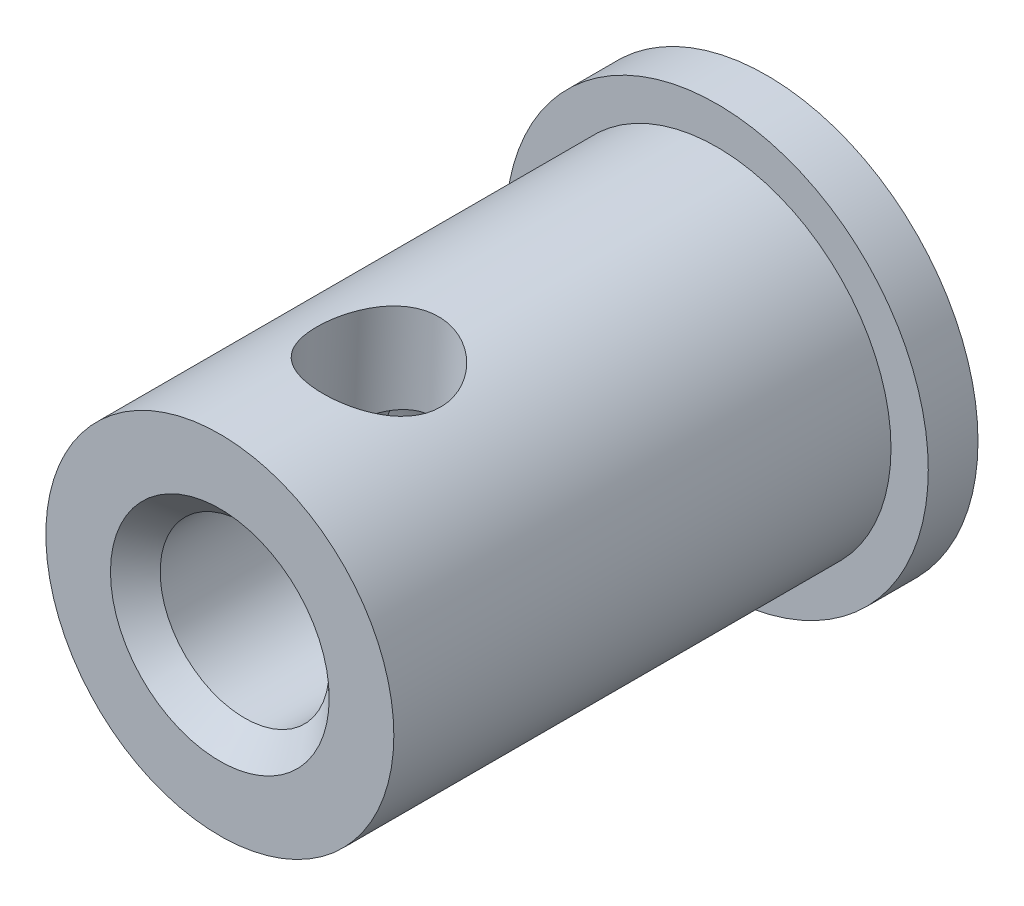
from build123d import *

# Parameters (mm, degrees)
SKETCH_1_R              = 4.25
EXTRUDE_1_DEPTH         = 1
SKETCH_2_R              = 3.5
EXTRUDE_2_DEPTH         = 10
HOLE_WIZARD_M31_D       = 3.4
HOLE_WIZARD_M31_DEPTH   = 5
HOLE_WIZARD_M31_TIP     = 1.021463052
CHAMFER_1_SIZE          = 0.5
HOLE_WIZARD_M31_2_D     = 2.5
HOLE_WIZARD_M31_2_DEPTH = 3
HOLE_WIZARD_M31_2_TIP   = 0.751075774


with BuildPart() as part:
    # Эскиз1 → Бобышка-Вытянуть1 (new body)
    with BuildSketch(Plane.XY):
        Circle(SKETCH_1_R)
    extrude(amount=EXTRUDE_1_DEPTH)

    # Эскиз2 → Бобышка-Вытянуть2 (add)
    with BuildSketch(Plane.XY.offset(1)):
        Circle(SKETCH_2_R)
    extrude(amount=EXTRUDE_2_DEPTH)

    # Hole Wizard M31
    with Locations(Plane.XY.offset(11)):
        with Locations((0, 0)):
            Hole(HOLE_WIZARD_M31_D / 2, depth=HOLE_WIZARD_M31_DEPTH)
            with Locations((0, 0, -(HOLE_WIZARD_M31_DEPTH + HOLE_WIZARD_M31_TIP / 2))):  # 118° drill point
                Cone(0, HOLE_WIZARD_M31_D / 2, HOLE_WIZARD_M31_TIP, mode=Mode.SUBTRACT)

    # Фаска1
    chamfer_1_edges = [part.edges().sort_by_distance(p)[0] for p in [
        (1.7, 0, 11),
    ]]
    chamfer(chamfer_1_edges, length=CHAMFER_1_SIZE)

    # Hole Wizard M31 2
    with Locations(Plane(origin=(0.206904612, 3.493879002, 8), x_dir=(0.998251143468, -0.059115603402, 0), z_dir=(0.059115603402, 0.998251143468, 0))):
        with Locations((0, 0)):
            Hole(HOLE_WIZARD_M31_2_D / 2, depth=HOLE_WIZARD_M31_2_DEPTH)
            with Locations((0, 0, -(HOLE_WIZARD_M31_2_DEPTH + HOLE_WIZARD_M31_2_TIP / 2))):  # 118° drill point
                Cone(0, HOLE_WIZARD_M31_2_D / 2, HOLE_WIZARD_M31_2_TIP, mode=Mode.SUBTRACT)


solid = part.part
